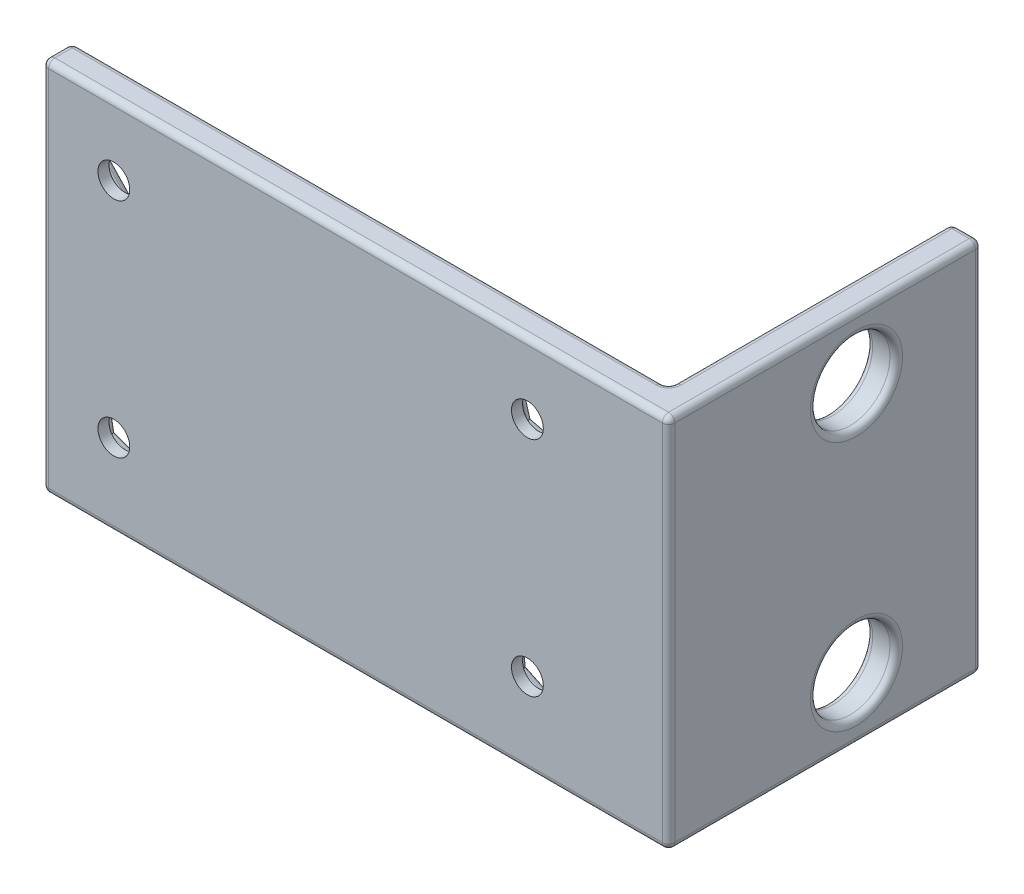
from build123d import *

# Parameters (mm, degrees)
BOSS_EXTRUDE1_DEPTH = 30
SKETCH2_R           = 1.27
CUT_EXTRUDE1_DEPTH  = 62.583645163
SKETCH3_R           = 3.175
CUT_EXTRUDE2_DEPTH  = 63.542848125
FILLET1_R           = 0.5
CUT_EXTRUDE3_DEPTH  = 1.5
FILLET2_R           = 0.5


with BuildPart() as part:
    # Sketch1 → Boss-Extrude1 (new body)
    with BuildSketch(Plane(origin=(0, 0, 0), x_dir=(1, 0, 0), z_dir=(0, 1, 0))):
        Polygon((0, 0), (0, 22.61875), (2.38125, 22.61875), (2.38125, -2.38125), (-47.61875, -2.38125), (-47.61875, 0), align=None)
    extrude(amount=BOSS_EXTRUDE1_DEPTH)

    # Sketch2 → Cut-Extrude1 (cut, through all)
    with BuildSketch(Plane.XY.offset(2.38125)):
        with Locations((-41.91, 6.599029345)):
            Circle(SKETCH2_R)
        with Locations((-8.89, 6.599029345)):
            Circle(SKETCH2_R)
        with Locations((-8.89, 24.379029345)):
            Circle(SKETCH2_R)
        with Locations((-41.91, 24.379029345)):
            Circle(SKETCH2_R)
    extrude(amount=-CUT_EXTRUDE1_DEPTH, mode=Mode.SUBTRACT)

    # Sketch3 → Cut-Extrude2 (cut, through all)
    with BuildSketch(Plane(origin=(2.38125, 0, 0), x_dir=(0, 0, -1), z_dir=(1, 0, 0))):
        with Locations((12.61875, 25)):
            Circle(SKETCH3_R)
        with Locations((12.61875, 5)):
            Circle(SKETCH3_R)
    extrude(amount=-CUT_EXTRUDE2_DEPTH, mode=Mode.SUBTRACT)

    # Fillet1
    fillet1_edges = [part.edges().sort_by_distance(p)[0] for p in [
        (0, 15, 0),
        (0, 15, -22.61875),
        (2.38125, 15, -22.61875),
        (2.38125, 15, 2.38125),
        (-47.61875, 15, 2.38125),
        (-47.61875, 15, 0),
        (-22.61875, 30, 2.38125),
        (2.38125, 30, -10.11875),
        (1.190625, 30, -22.61875),
        (-43.18, 24.379029345, 0),
        (0, 30, -11.309375),
        (-10.16, 24.379029345, 0),
        (-10.16, 6.599029345, 0),
        (-43.18, 6.599029345, 0),
        (0, 25, -9.44375),
        (2.38125, 25, -9.44375),
        (0, 5, -9.44375),
        (2.38125, 5, -9.44375),
        (-23.809375, 30, 0),
        (0, 0, -11.309375),
        (1.190625, 0, -22.61875),
        (2.38125, 0, -10.11875),
        (-22.61875, 0, 2.38125),
        (-47.61875, 0, 1.190625),
        (-23.809375, 0, 0),
        (-47.61875, 30, 1.190625),
    ]]
    fillet(fillet1_edges, radius=FILLET1_R)

    # Sketch5 → Cut-Extrude3 (cut)
    with BuildSketch(Plane(origin=(0, 0, 0), x_dir=(-1, 0, 0), z_dir=(0, 0, -1))):
        Polygon((10.803922519, 22.374808651), (11.582667295, 25.03442452), (9.668744776, 27.038645215), (6.976077481, 26.383250039), (6.197332705, 23.72363417), (8.111255224, 21.719413476), align=None)
        Polygon((11.170798312, 5.024875902), (11.393656027, 7.787181903), (9.112857715, 9.361335345), (6.609201688, 8.173182788), (6.386343973, 5.410876787), (8.667142285, 3.836723345), align=None)
        Polygon((39.303735012, 5.657019359), (41.422672085, 3.870932664), (44.028937073, 4.81294265), (44.516264988, 7.541039332), (42.397327915, 9.327126027), (39.791062927, 8.38511604), align=None)
        Polygon((39.996077481, 22.374808651), (42.688744776, 21.719413476), (44.602667295, 23.72363417), (43.823922519, 26.383250039), (41.131255224, 27.038645215), (39.217332705, 25.03442452), align=None)
    extrude(amount=-CUT_EXTRUDE3_DEPTH, mode=Mode.SUBTRACT)

    # Fillet2
    fillet2_edges = [part.edges().sort_by_distance(p)[0] for p in [
        (-39.606705093, 23.704616586, 0),
        (-41.342411129, 22.047111063, 0),
        (-43.645706036, 22.721523823, 0),
        (-44.213294907, 25.053442104, 0),
        (-42.477588871, 26.710947627, 0),
        (-40.174293964, 26.036534868, 0),
        (-39.54739897, 7.021067699, 0),
        (-40.363203549, 4.763976011, 0),
        (-42.725804579, 4.341937657, 0),
        (-44.27260103, 6.176990991, 0),
        (-43.456796451, 8.434082679, 0),
        (-41.094195421, 8.856121033, 0),
        (-9.918970299, 4.430799624, 0),
        (-11.282227169, 6.406028903, 0),
        (-10.253256871, 8.574258624, 0),
        (-7.861029701, 8.767259066, 0),
        (-6.497772831, 6.792029788, 0),
        (-7.526743129, 4.623800066, 0),
        (-9.457588871, 22.047111063, 0),
        (-11.193294907, 23.704616586, 0),
        (-10.625706036, 26.036534868, 0),
        (-8.322411129, 26.710947627, 0),
        (-6.586705093, 25.053442104, 0),
        (-7.154293964, 22.721523823, 0),
    ]]
    fillet(fillet2_edges, radius=FILLET2_R)


solid = part.part
